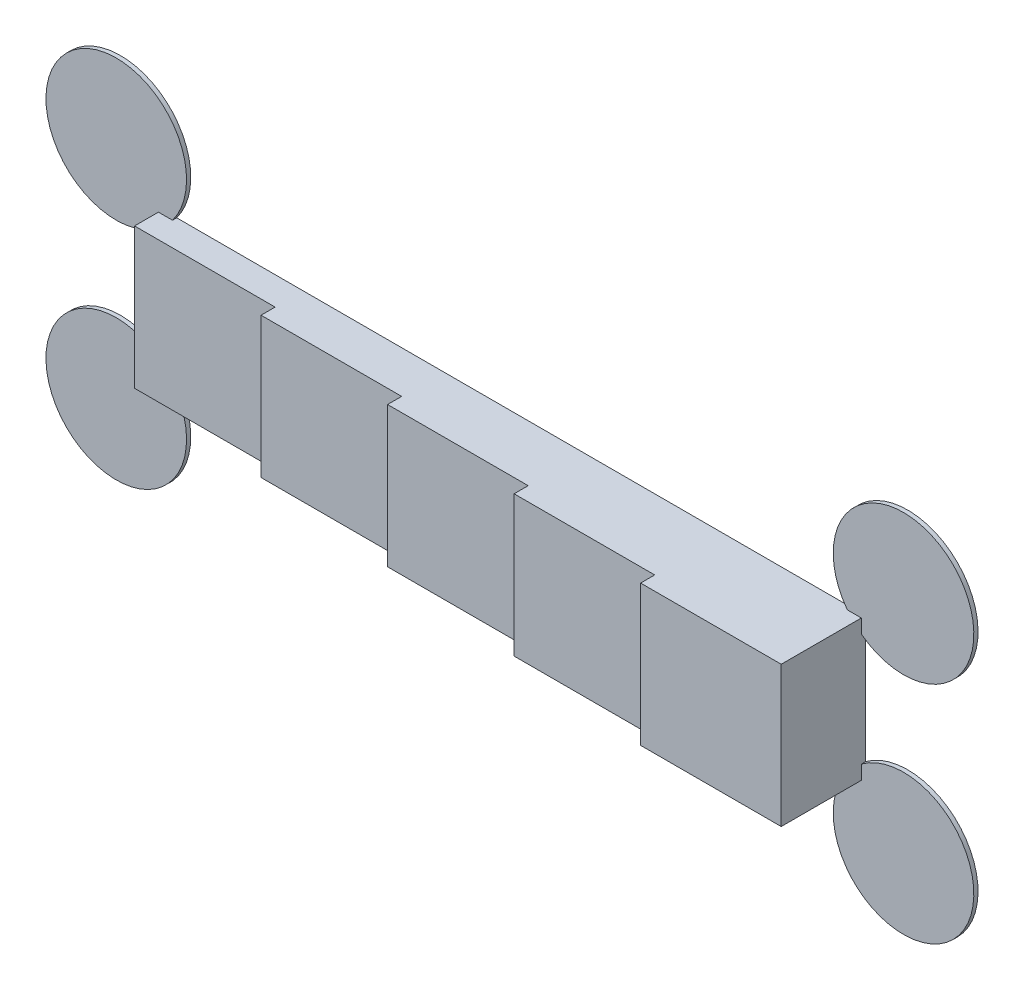
from build123d import *

# Parameters (mm, degrees)
SKETCH1_W        = 50
SKETCH1_H        = 10
F_2MM_DEPTH      = 2
SKETCH2_W        = 40
SKETCH2_H        = 10
F_3MM_DEPTH      = 1
SKETCH3_W        = 30
SKETCH3_H        = 10
F_4MM_DEPTH      = 1
SKETCH4_W        = 20
SKETCH4_H        = 10
F_5MM_DEPTH      = 1
SKETCH5_W        = 10
SKETCH5_H        = 10
F_6MM_DEPTH      = 1
SKETCH6_R        = 5
PRINT_EARS_DEPTH = 0.3


with BuildPart() as part:
    # Sketch1 → 2mm (new body)
    with BuildSketch(Plane.XY):
        with Locations((25, 5)):
            Rectangle(SKETCH1_W, SKETCH1_H)
    extrude(amount=F_2MM_DEPTH)

    # Sketch2 → 3mm (add)
    with BuildSketch(Plane.XY.offset(2)):
        with Locations((30, 5)):
            Rectangle(SKETCH2_W, SKETCH2_H)
    extrude(amount=F_3MM_DEPTH)

    # Sketch3 → 4mm (add)
    with BuildSketch(Plane.XY.offset(3)):
        with Locations((35, 5)):
            Rectangle(SKETCH3_W, SKETCH3_H)
    extrude(amount=F_4MM_DEPTH)

    # Sketch4 → 5mm (add)
    with BuildSketch(Plane.XY.offset(4)):
        with Locations((40, 5)):
            Rectangle(SKETCH4_W, SKETCH4_H)
    extrude(amount=F_5MM_DEPTH)

    # Sketch5 → 6mm (add)
    with BuildSketch(Plane.XY.offset(5)):
        with Locations((45, 5)):
            Rectangle(SKETCH5_W, SKETCH5_H)
    extrude(amount=F_6MM_DEPTH)

    # Sketch6 → Print ears (add)
    with BuildSketch(Plane(origin=(0, 0, 0), x_dir=(-1, 0, 0), z_dir=(0, 0, -1))):
        with Locations((3, -3)):
            Circle(SKETCH6_R)
        with Locations((3, 13)):
            Circle(SKETCH6_R)
        with Locations((-53, 13)):
            Circle(SKETCH6_R)
        with Locations((-53, -3)):
            Circle(SKETCH6_R)
    extrude(amount=-PRINT_EARS_DEPTH)


solid = part.part
